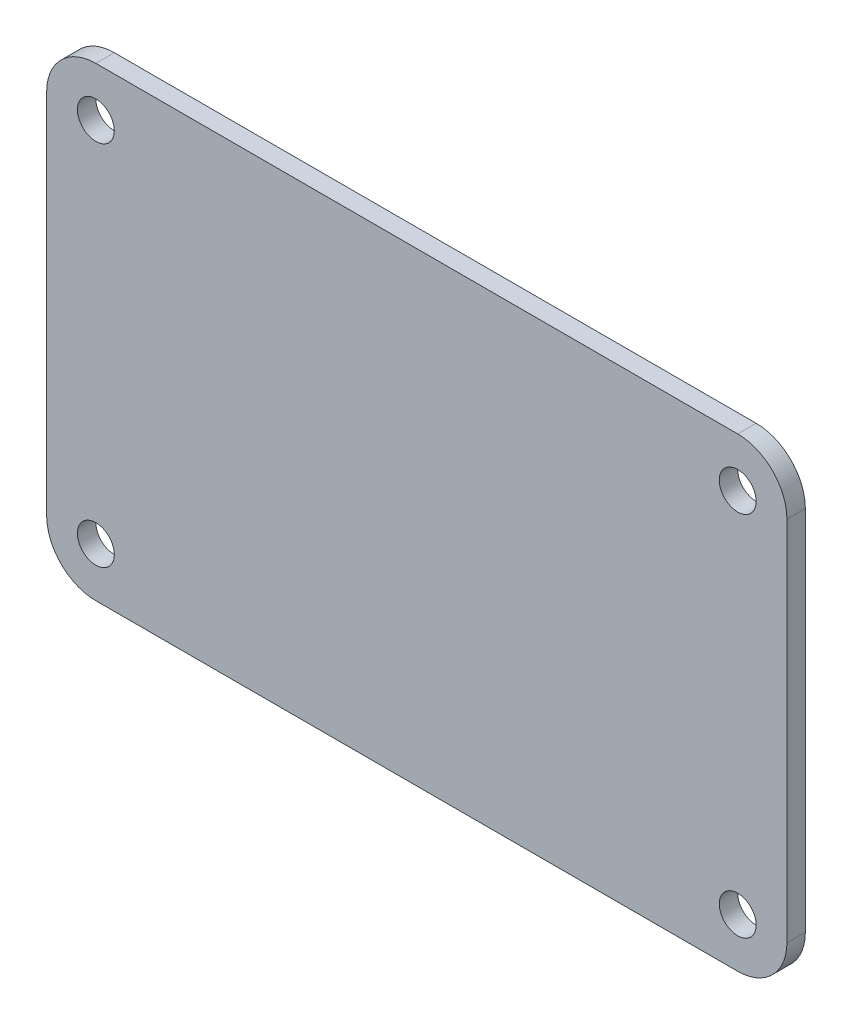
from build123d import *

# Parameters (mm, degrees)
SKETCH1_R           = 1.5
BOSS_EXTRUDE1_DEPTH = 1.5


with BuildPart() as part:
    # Sketch1 → Boss-Extrude1 (new body)
    with BuildSketch(Plane.XY):
        with BuildLine():
            Line((-26.095, 18.92), (26.095, 18.92))
            ThreePointArc((26.095, 18.92), (28.923427125, 17.748427125), (30.095, 14.92))
            Line((30.095, 14.92), (30.095, -14.92))
            ThreePointArc((30.095, -14.92), (28.923427125, -17.748427125), (26.095, -18.92))
            Line((26.095, -18.92), (-26.095, -18.92))
            ThreePointArc((-26.095, -18.92), (-28.923427125, -17.748427125), (-30.095, -14.92))
            Line((-30.095, -14.92), (-30.095, 14.92))
            ThreePointArc((-30.095, 14.92), (-28.923427125, 17.748427125), (-26.095, 18.92))
        make_face()
        with Locations((-26.095, 14.92)):
            Circle(SKETCH1_R, mode=Mode.SUBTRACT)
        with Locations((-26.095, -14.92)):
            Circle(SKETCH1_R, mode=Mode.SUBTRACT)
        with Locations((26.095, 14.92)):
            Circle(SKETCH1_R, mode=Mode.SUBTRACT)
        with Locations((26.095, -14.92)):
            Circle(SKETCH1_R, mode=Mode.SUBTRACT)
    extrude(amount=BOSS_EXTRUDE1_DEPTH)


solid = part.part
